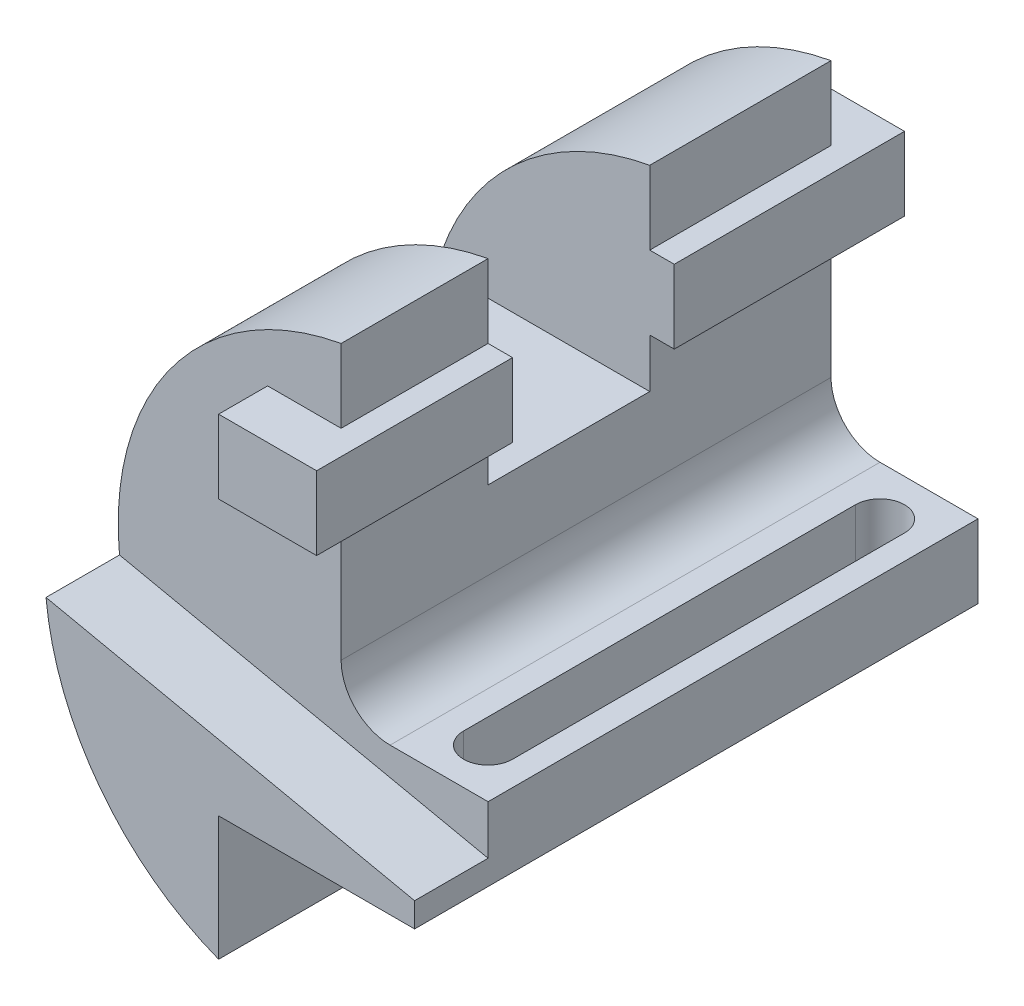
from build123d import *

# Parameters (mm, degrees)
BOSS_EXTRUDE1_DEPTH      = 115
CUT_EXTRUDE1_START       = -15
CUT_EXTRUDE1_DEPTH       = 15
BOSS_EXTRUDE2_DEPTH      = 10
BOSS_EXTRUDE2_DEPTH_BACK = 110
SKETCH3_W                = 20
SKETCH3_H                = 15
CUT_EXTRUDE3_DEPTH       = 148.83859442
CUT_EXTRUDE3_DEPTH_BACK  = 148.83859442
SKETCH4_W                = 33
SKETCH4_H                = 40
CUT_EXTRUDE4_DEPTH       = 153.581945197
CUT_EXTRUDE4_DEPTH_BACK  = 153.581945197
FILLET1_R                = 10


with BuildPart() as part:
    # Sketch1 → Boss-Extrude1 (new body)
    with BuildSketch(Plane.XY):
        with BuildLine():
            Line((0, 0), (-40, 0))
            Line((-40, 0), (-40, -25.362796982))
            ThreePointArc((-40, -25.362796982), (-75.256322222, 31.603413808), (-30, 81))
            Line((-30, 81), (-30, 15))
            Line((-30, 15), (0, 15))
            Line((0, 15), (0, 0))
        make_face()
    extrude(amount=BOSS_EXTRUDE1_DEPTH)

    # Sketch2 → Cut-Extrude1 (cut)
    with BuildSketch(Plane.XY.offset(115).offset(CUT_EXTRUDE1_START)):
        with BuildLine():
            Line((0, 5), (-75.235044142, 20.9917023))
            ThreePointArc((-75.235044142, 20.9917023), (-64.318751046, 59.816391467), (-30, 81))
            Line((-30, 81), (-30, 15))
            Line((-30, 15), (0, 15))
            Line((0, 15), (0, 5))
        make_face()
    extrude(amount=CUT_EXTRUDE1_DEPTH, mode=Mode.SUBTRACT)

    # Sketch3 → Boss-Extrude2 (add, two sides: drawn at the far end of the back side and taken through both)
    with BuildSketch(Plane(origin=(0, 0, 0), x_dir=(-1, 0, 0), z_dir=(0, 0, -1)).offset(-BOSS_EXTRUDE2_DEPTH_BACK)):
        with Locations((35, 58.5)):
            Rectangle(SKETCH3_W, SKETCH3_H)
    extrude(amount=BOSS_EXTRUDE2_DEPTH + BOSS_EXTRUDE2_DEPTH_BACK)

    # Sketch4 → Cut-Extrude3 (cut, two sides: drawn at the far end of the back side and taken through both)
    with BuildSketch(Plane(origin=(-30, 0, 0), x_dir=(0, 0, -1), z_dir=(1, 0, 0)).offset(-CUT_EXTRUDE3_DEPTH_BACK)):
        with Locations((-53.5, 61)):
            Rectangle(SKETCH4_W, SKETCH4_H)
    extrude(amount=CUT_EXTRUDE3_DEPTH + CUT_EXTRUDE3_DEPTH_BACK, mode=Mode.SUBTRACT)

    # Sketch5 → Cut-Extrude4 (cut, two sides: drawn at the far end of the back side and taken through both)
    with BuildSketch(Plane(origin=(0, 15, 0), x_dir=(1, 0, 0), z_dir=(0, 1, 0)).offset(-CUT_EXTRUDE4_DEPTH_BACK)):
        with BuildLine():
            Line((-5, -10), (-5, -90))
            ThreePointArc((-5, -90), (-10, -95), (-15, -90))
            Line((-15, -90), (-15, -10))
            ThreePointArc((-15, -10), (-10, -5), (-5, -10))
        make_face()
    extrude(amount=CUT_EXTRUDE4_DEPTH + CUT_EXTRUDE4_DEPTH_BACK, mode=Mode.SUBTRACT)

    # Fillet1
    fillet1_edges = [part.edges().sort_by_distance(p)[0] for p in [
        (-30, 15, 50),
    ]]
    fillet(fillet1_edges, radius=FILLET1_R)


solid = part.part
